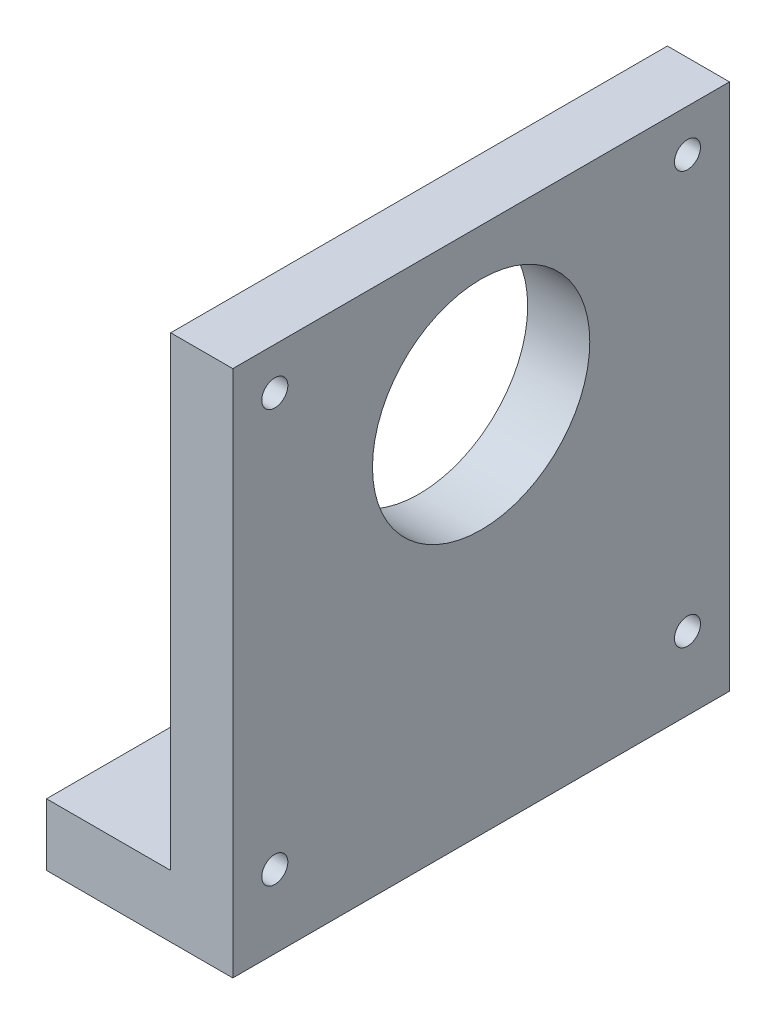
from build123d import *

# Parameters (mm, degrees)
EXTRUDE_1_DEPTH             = 40
CUT_EXTRUDE_2_REACH         = 89.321
HOLE_WIZARD_M5_1_AT_2_COUNT = 2
HOLE_WIZARD_M5_1_AT_2_PITCH = 66.468037432
HOLE_WIZARD_M5_1_AT_3_COUNT = 2
HOLE_WIZARD_M5_1_AT_3_PITCH = 94
HOLE_WIZARD_M5_1_AT_4_COUNT = 2
HOLE_WIZARD_M5_1_AT_4_PITCH = 66.468037432
SKETCH_5_R                  = 17.5
CUT_EXTRUDE_3_DEPTH         = 10


with BuildPart() as part:
    # 草图1 → 拉伸1 (new, symmetric)
    with BuildSketch(Plane.XY):
        Polygon((-20, 0), (10, 0), (10, 85), (0, 85), (0, 10), (-20, 10), align=None)
    extrude(amount=EXTRUDE_1_DEPTH, both=True)

    # 草图2 → 拉伸2 (cut, up to next)
    with BuildSketch(Plane(origin=(0, 10, 0), x_dir=(1, 0, 0), z_dir=(0, 1, 0)), mode=Mode.PRIVATE) as cut_extrude_2_sk1:
        with BuildLine():
            Line((-13.5, 25), (-13.5, 15))
            ThreePointArc((-13.5, 15), (-10, 11.5), (-6.5, 15))
            Line((-6.5, 15), (-6.5, 25))
            ThreePointArc((-6.5, 25), (-10, 28.5), (-13.5, 25))
        make_face()
    cut_extrude_2_tool1 = extrude(cut_extrude_2_sk1.sketch, amount=-CUT_EXTRUDE_2_REACH, mode=Mode.PRIVATE) & part.part
    # 草图2 → 拉伸2 (cut, up to next)
    with BuildSketch(Plane(origin=(0, 10, 0), x_dir=(1, 0, 0), z_dir=(0, 1, 0)), mode=Mode.PRIVATE) as cut_extrude_2_sk2:
        with BuildLine():
            Line((-13.5, -15), (-13.5, -25))
            ThreePointArc((-13.5, -25), (-10, -28.5), (-6.5, -25))
            Line((-6.5, -25), (-6.5, -15))
            ThreePointArc((-6.5, -15), (-10, -11.5), (-13.5, -15))
        make_face()
    cut_extrude_2_tool2 = extrude(cut_extrude_2_sk2.sketch, amount=-CUT_EXTRUDE_2_REACH, mode=Mode.PRIVATE) & part.part
    add(cut_extrude_2_tool1.solids().sort_by_distance((-10, 10, -20))[0], mode=Mode.SUBTRACT)
    add(cut_extrude_2_tool2.solids().sort_by_distance((-10, 10, 20))[0], mode=Mode.SUBTRACT)

    # 草图3 → M5 螺纹孔1 (revolve, cut)
    with BuildSketch(Plane(origin=(0, 78.234018716, 33.234018716), x_dir=(0, 0, 1), z_dir=(0, 1, 0))):
        Polygon((0, 0), (0, 15.2618073), (2.1, 14), (2.1, 0), align=None)
    hole_wizard_m5_1 = revolve(axis=Axis((-6.35, 78.234018716, 33.234018716), (1, 0, 0)), mode=Mode.SUBTRACT)

    # M5 螺纹孔1 at 2: M5 螺纹孔1 ×2
    with Locations(*[(0, 0, -i * HOLE_WIZARD_M5_1_AT_2_PITCH) for i in range(1, HOLE_WIZARD_M5_1_AT_2_COUNT)]):
        add(hole_wizard_m5_1, mode=Mode.SUBTRACT)

    # M5 螺纹孔1 at 3: M5 螺纹孔1 ×2
    with Locations(*[Vector(0, -0.7071067811865464, -0.7071067811865487) * (i * HOLE_WIZARD_M5_1_AT_3_PITCH) for i in range(1, HOLE_WIZARD_M5_1_AT_3_COUNT)]):
        add(hole_wizard_m5_1, mode=Mode.SUBTRACT)

    # M5 螺纹孔1 at 4: M5 螺纹孔1 ×2
    with Locations(*[(0, -i * HOLE_WIZARD_M5_1_AT_4_PITCH, 0) for i in range(1, HOLE_WIZARD_M5_1_AT_4_COUNT)]):
        add(hole_wizard_m5_1, mode=Mode.SUBTRACT)

    # 草图5 → 拉伸3 (cut)
    with BuildSketch(Plane.ZY):
        with Locations(Location((0, 60, 0), (0, 0, 270))):
            Circle(SKETCH_5_R)
    extrude(amount=-CUT_EXTRUDE_3_DEPTH, mode=Mode.SUBTRACT)


solid = part.part
